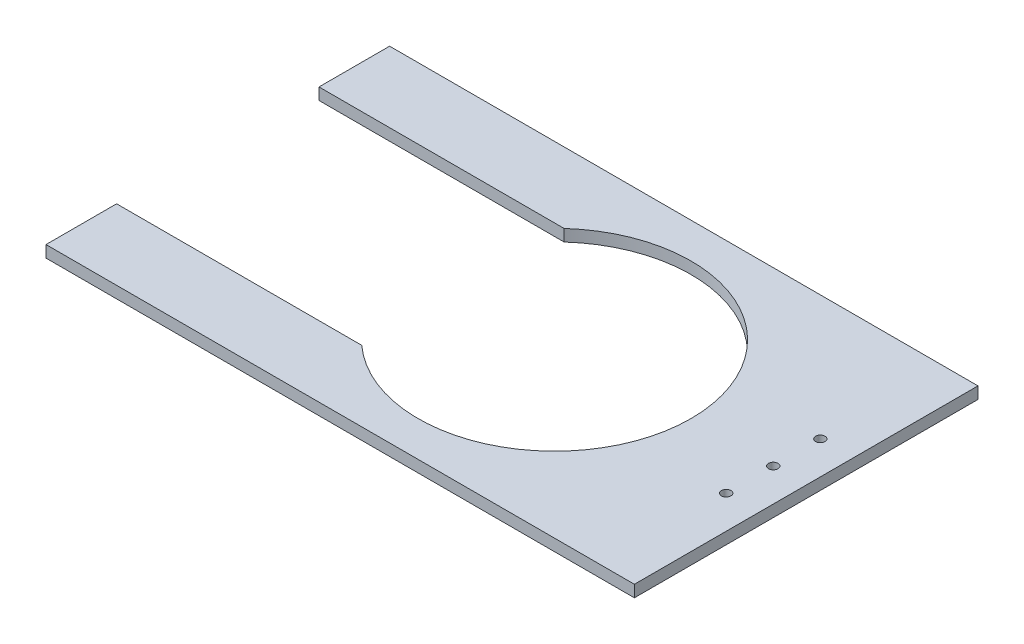
from build123d import *

# Parameters (mm, degrees)
SKETCH1_R           = 2
BOSS_EXTRUDE1_DEPTH = 5


with BuildPart() as part:
    # Sketch1 → Boss-Extrude1 (new body)
    with BuildSketch(Plane(origin=(0, 0, 0), x_dir=(1, 0, 0), z_dir=(0, 1, 0))):
        with BuildLine():
            Line((-228.663769869, 10), (-118.663769869, 10))
            Line((-118.663769869, 10), (21.336230131, 10))
            Line((21.336230131, 10), (21.336230131, -106))
            Line((21.336230131, -106), (21.336230131, -136))
            Line((21.336230131, -136), (-118.663769869, -136))
            Line((-118.663769869, -136), (-228.663769869, -136))
            Line((-228.663769869, -136), (-228.663769869, -106))
            Line((-228.663769869, -106), (-124.517389937, -106))
            ThreePointArc((-124.517389937, -106), (-27.594389025, -63), (-124.517389937, -20))
            Line((-124.517389937, -20), (-228.663769869, -20))
            Line((-228.663769869, -20), (-228.663769869, 10))
        make_face()
        with Locations(Location((7.336230131, -63, 0), (0, 0, 270))):
            Circle(SKETCH1_R, mode=Mode.SUBTRACT)
        with Locations(Location((7.336230131, -43, 0), (0, 0, 270))):
            Circle(SKETCH1_R, mode=Mode.SUBTRACT)
        with Locations(Location((7.336230131, -83, 0), (0, 0, 270))):
            Circle(SKETCH1_R, mode=Mode.SUBTRACT)
    extrude(amount=BOSS_EXTRUDE1_DEPTH)


solid = part.part
